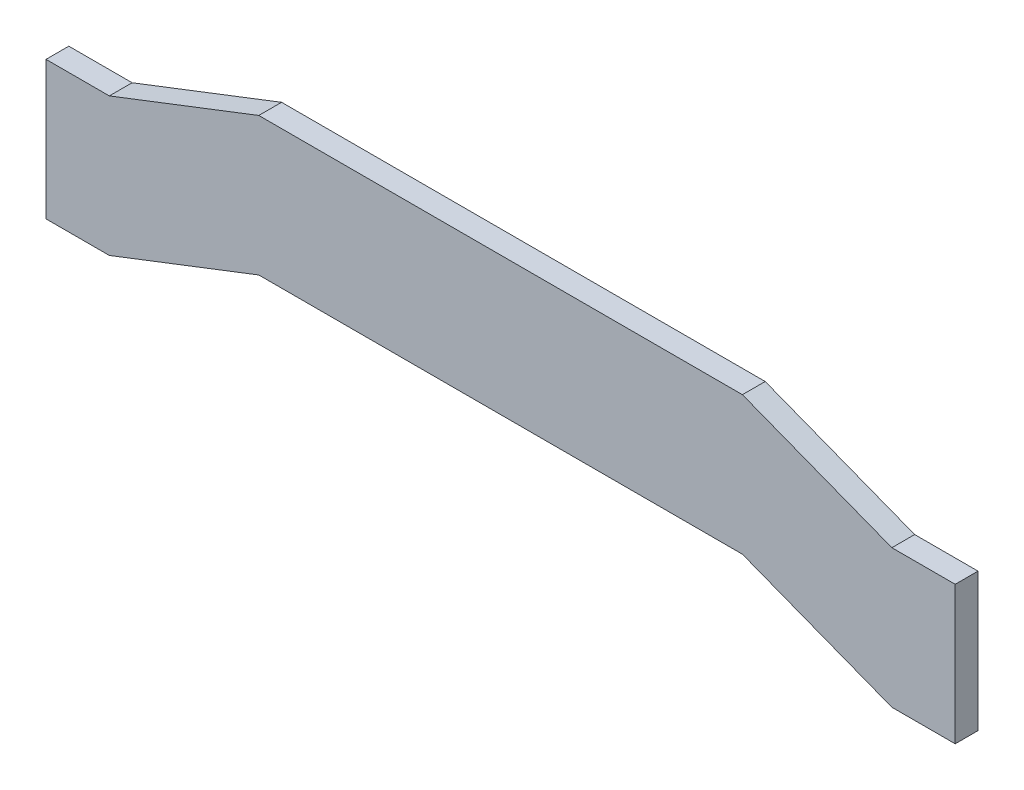
from build123d import *

# Parameters (mm, degrees)
RESSALTO_EXTRUS_O1_DEPTH = 19.8


with BuildPart() as part:
    # Esboço1 → Ressalto-extrusão1 (new body)
    with BuildSketch(Plane.XY):
        Polygon((-210, 70), (210, 70), (339.8, 19.8), (394.8, 19.8), (394.8, 139.8), (339.8, 139.8), (210, 190), (-210, 190), (-339.8, 139.8), (-394.8, 139.8), (-394.8, 19.8), (-339.8, 19.8), align=None)
    extrude(amount=RESSALTO_EXTRUS_O1_DEPTH)


solid = part.part
